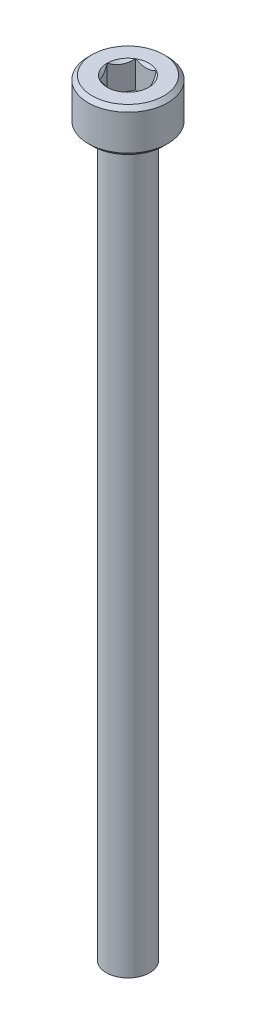
from build123d import *

# Parameters (mm, degrees)
SKETCH1_R           = 2.75
BOSS_EXTRUDE1_DEPTH = 3
CUT_EXTRUDE1_DEPTH  = 1.88
CHAMFER1_SIZE       = 0.275
SKETCH_1_R          = 1.5
EXTRUDE_1_DEPTH     = 50


with BuildPart() as part:
    # Sketch1 → Boss-Extrude1 (new body)
    with BuildSketch(Plane(origin=(0, 0, 0), x_dir=(1, 0, 0), z_dir=(0, 1, 0))):
        with Locations(Location((0, 0, 0), (0, 0, 270))):
            Circle(SKETCH1_R)
    extrude(amount=BOSS_EXTRUDE1_DEPTH)

    # Sketch2 → Cut-Extrude1 (cut)
    with BuildSketch(Plane(origin=(0, 3, 0), x_dir=(1, 0, 0), z_dir=(0, 1, 0))):
        Polygon((0.721687836, 1.25), (-0.721687836, 1.25), (-1.443375673, 0), (-0.721687836, -1.25), (0.721687836, -1.25), (1.443375673, 0), align=None)
    extrude(amount=-CUT_EXTRUDE1_DEPTH, mode=Mode.SUBTRACT)

    # Cut-Extrude2 cone 1 section (through the dimple's axis) → Cut-Extrude2 (revolve, cut)
    with BuildSketch(Plane(origin=(0, 3, 0), x_dir=(0, 0, 1), z_dir=(1, 0, 0))):
        Polygon((0, 0), (1.443375673, 0), (0, 1.443375673), align=None)
    revolve(axis=Axis((0, 3, 0), (0, -1, 0)), mode=Mode.SUBTRACT)

    # Chamfer1
    chamfer1_edges = [part.edges().sort_by_distance(p)[0] for p in [
        (0, 0, -2.75),
        (0, 3, -2.75),
    ]]
    chamfer(chamfer1_edges, length=CHAMFER1_SIZE)

    # 草图1 → 凸台-拉伸1 (add)
    with BuildSketch(Plane(origin=(0, 0, 0), x_dir=(-1, 0, 0), z_dir=(0, -1, 0))):
        with Locations(Location((0, 0, 0), (0, 0, 90))):
            Circle(SKETCH_1_R)
    extrude(amount=EXTRUDE_1_DEPTH)


solid = part.part
